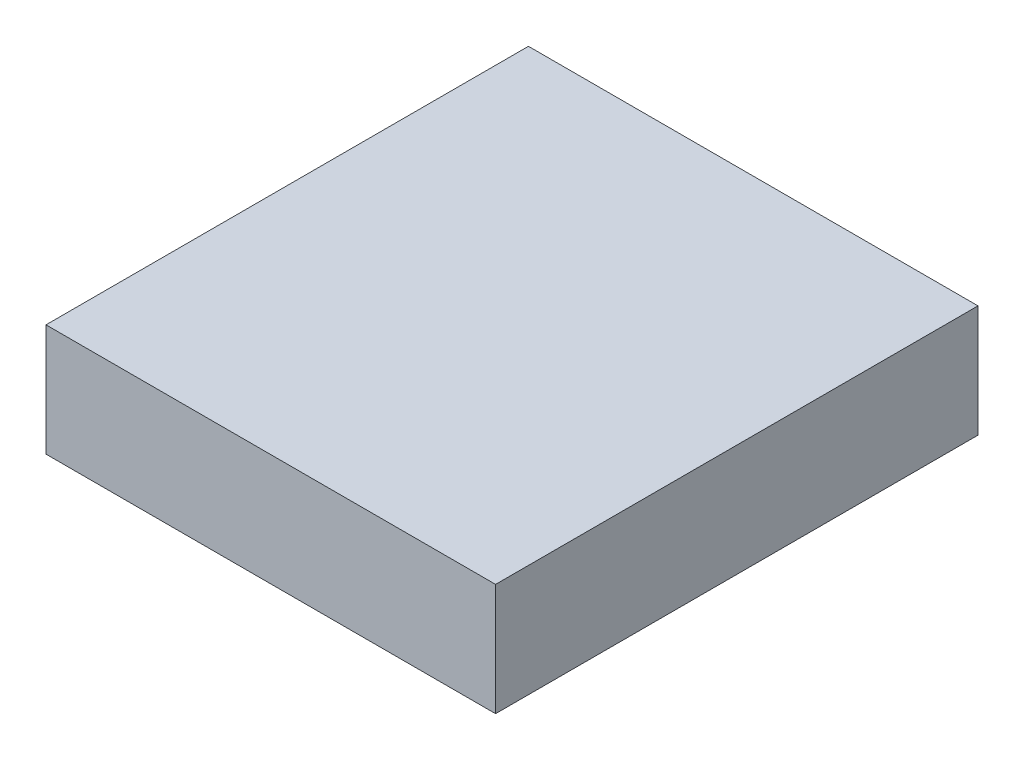
from build123d import *

# Parameters (mm, degrees)
SKETCH1_W           = 93.187532809
SKETCH1_H           = 23.215981166
BOSS_EXTRUDE1_DEPTH = 100


with BuildPart() as part:
    # Sketch1 → Boss-Extrude1 (new body)
    with BuildSketch(Plane.XY):
        with Locations((46.593766405, 11.607990583)):
            Rectangle(SKETCH1_W, SKETCH1_H)
    extrude(amount=BOSS_EXTRUDE1_DEPTH)


solid = part.part
